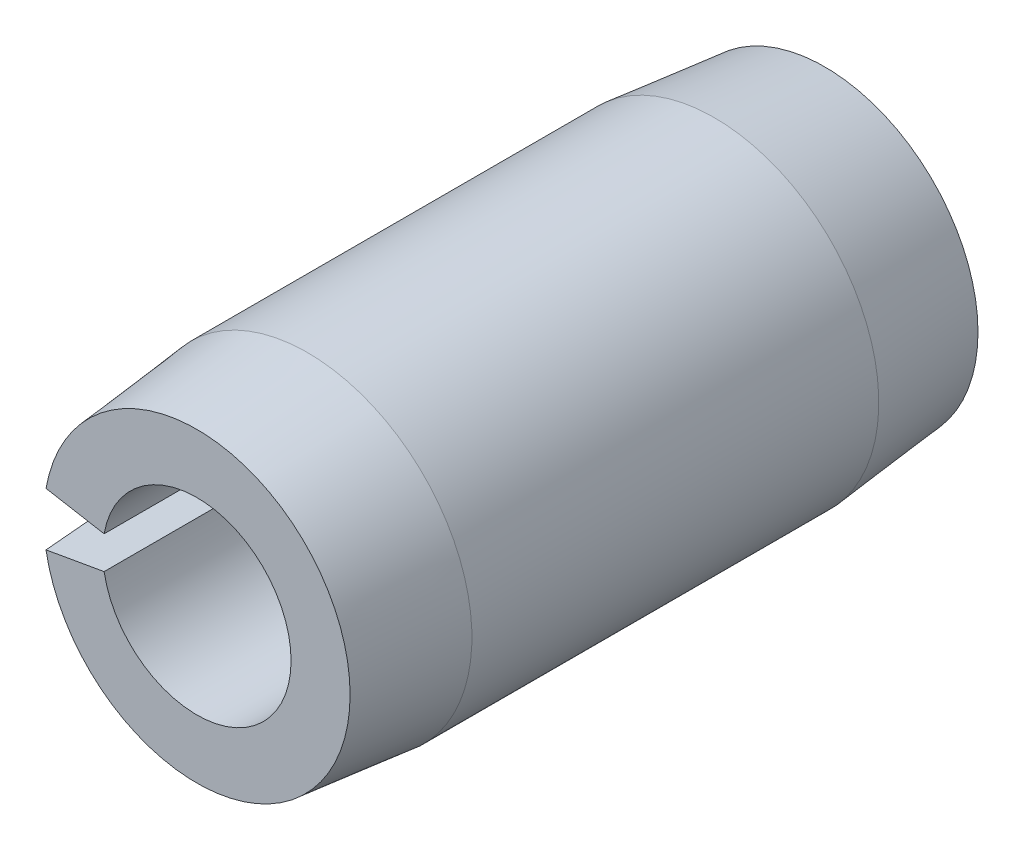
from build123d import *

# Parameters (mm, degrees)
EXTRUDE1_DEPTH = 3.175


with BuildPart() as part:
    # Sketch1 → Extrude1 (new, symmetric)
    with BuildSketch(Plane.XY):
        with BuildLine():
            Line((-1.638424659, 0.288898473), (-0.938029385, 0.165399889))
            ThreePointArc((-0.938029385, 0.165399889), (0.9525, 0), (-0.938029385, -0.165399889))
            Line((-0.938029385, -0.165399889), (-1.638424659, -0.288898473))
            ThreePointArc((-1.638424659, -0.288898473), (1.6637, 0), (-1.638424659, 0.288898473))
        make_face()
    extrude(amount=EXTRUDE1_DEPTH, both=True)

    # Sketch2 → Cut-Revolve1 (revolve, cut)
    with BuildSketch(Plane(origin=(0, 0, 0), x_dir=(0, 0, -1), z_dir=(1, 0, 0))):
        Polygon((3.175, 1.6637), (3.175, 1.5494), (2.0574, 1.6637), align=None)
        Polygon((-2.0574, 1.6637), (-3.175, 1.6637), (-3.175, 1.5494), align=None)
    revolve(axis=Axis((0, 0, -3.175), (0, 0, 1)), mode=Mode.SUBTRACT)


solid = part.part
